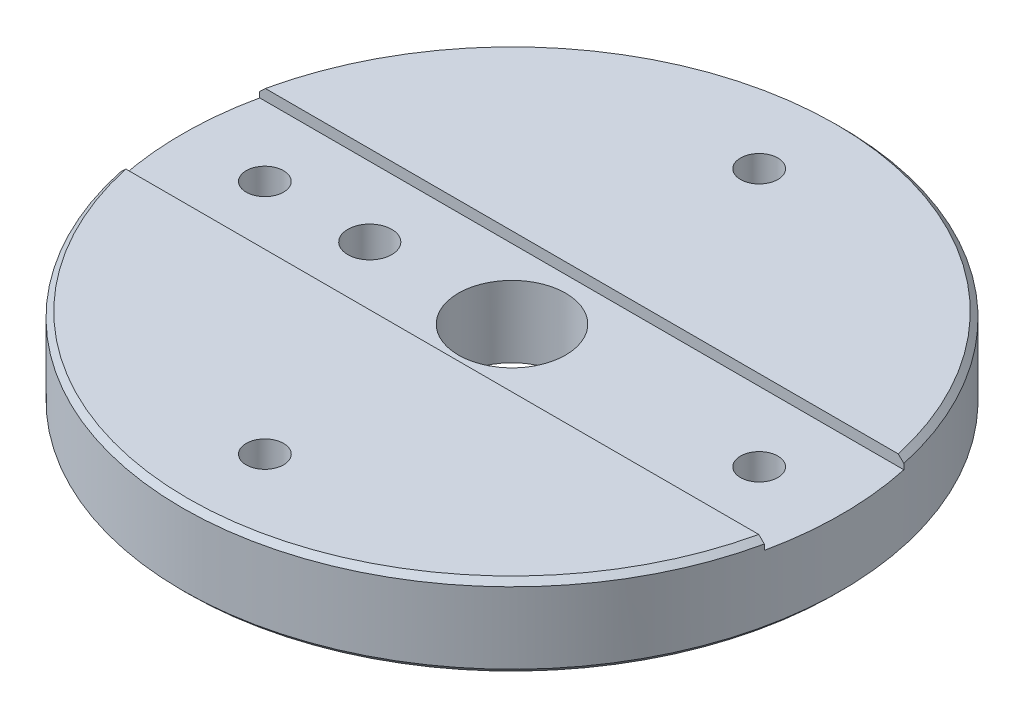
from build123d import *

# Parameters (mm, degrees)
SKETCH1_R                      = 60
SKETCH1_R_2                    = 9.765
BOSS_EXTRUDE1_DEPTH            = 15
CHAMFER1_SIZE                  = 1
M8_TAPPED_HOLE1_D              = 6.8
SKETCH5_R                      = 10
CUT_EXTRUDE1_DEPTH             = 3
CIRPATTERN1_COUNT              = 12
SKETCH7_W                      = 120
SKETCH7_H                      = 25.4
CUT_EXTRUDE2_DEPTH             = 2
CUT_EXTRUDE3_REACH             = 88.168
SKETCH8_R                      = 4
CUT_EXTRUDE3_DIRECTION_2_DEPTH = 87.168439698


with BuildPart() as part:
    # Sketch1 → Boss-Extrude1 (new body)
    with BuildSketch(Plane(origin=(0, 0, 0), x_dir=(1, 0, 0), z_dir=(0, 1, 0))):
        with Locations(Location((0, 0, 0), (0, 0, 270))):
            Circle(SKETCH1_R)
        with Locations(Location((0, 0, 0), (0, 0, 270))):
            Circle(SKETCH1_R_2, mode=Mode.SUBTRACT)
    extrude(amount=-BOSS_EXTRUDE1_DEPTH)

    # Chamfer1
    chamfer1_edges = [part.edges().sort_by_distance(p)[0] for p in [
        (0, 0, -60),
        (0, -15, -60),
    ]]
    chamfer(chamfer1_edges, length=CHAMFER1_SIZE)

    # M8 Tapped Hole1 (through all)
    with Locations(Plane(origin=(0, 0, 0), x_dir=(1, 0, 0), z_dir=(0, 1, 0))):
        with Locations((-45, 0), (0, -45), (0, 45), (45, 0)):
            Hole(M8_TAPPED_HOLE1_D / 2)

    # Sketch5 → Cut-Extrude1 (cut)
    with BuildSketch(Plane.XZ.offset(15)):
        with Locations(Location((0, 45, 0), (0, 0, 270))):
            Circle(SKETCH5_R)
    cut_extrude1 = extrude(amount=-CUT_EXTRUDE1_DEPTH, mode=Mode.SUBTRACT)

    # CirPattern1: Cut-Extrude1 ×12 about axis
    cirpattern1_axis = Axis((0, 0, 0), (0, 1, 0))
    for i in range(1, CIRPATTERN1_COUNT):
        add(cut_extrude1.rotate(cirpattern1_axis, i * 360 / CIRPATTERN1_COUNT), mode=Mode.SUBTRACT)

    # Sketch7 → Cut-Extrude2 (cut)
    with BuildSketch(Plane(origin=(0, 0, 0), x_dir=(1, 0, 0), z_dir=(0, 1, 0))):
        Rectangle(SKETCH7_W, SKETCH7_H)
    extrude(amount=-CUT_EXTRUDE2_DEPTH, mode=Mode.SUBTRACT)

    # Sketch8 → Cut-Extrude3 (cut, up to next)
    with BuildSketch(Plane(origin=(0, 0, 0), x_dir=(1, 0, 0), z_dir=(0, 1, 0)), mode=Mode.PRIVATE) as cut_extrude3_sk1:
        with Locations(Location((-25.9, 0, 0), (0, 0, 270))):
            Circle(SKETCH8_R)
    cut_extrude3_tool1 = extrude(cut_extrude3_sk1.sketch, amount=-CUT_EXTRUDE3_REACH, mode=Mode.PRIVATE) & part.part
    add(cut_extrude3_tool1.solids().sort_by_distance((-25.9, 0, 0))[0], mode=Mode.SUBTRACT)

    # Sketch8 → Cut-Extrude3 direction 2 (cut)
    with BuildSketch(Plane(origin=(0, 0, 0), x_dir=(1, 0, 0), z_dir=(0, 1, 0))):
        with Locations(Location((-25.9, 0, 0), (0, 0, 270))):
            Circle(SKETCH8_R)
    extrude(amount=CUT_EXTRUDE3_DIRECTION_2_DEPTH, mode=Mode.SUBTRACT)


solid = part.part
